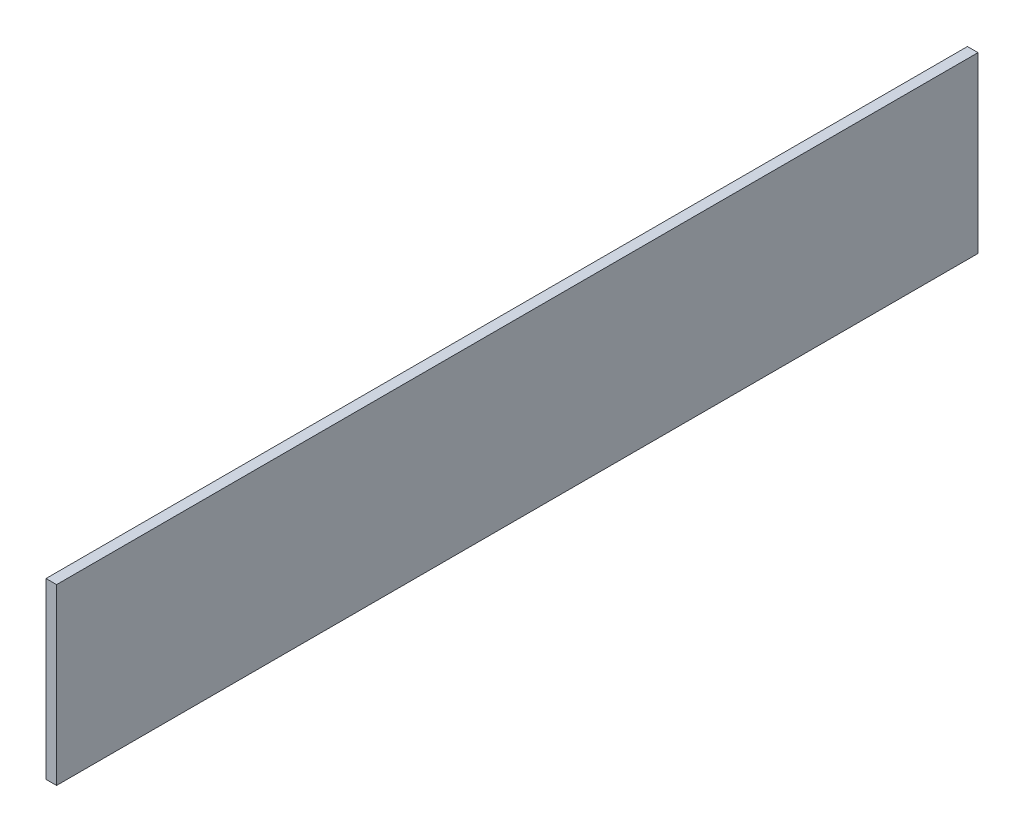
from build123d import *

# Parameters (mm, degrees)
SKETCH2_W           = 3.403820787
SKETCH2_H           = 296.618940246
BOSS_EXTRUDE1_DEPTH = 56


with BuildPart() as part:
    # Sketch2 → Boss-Extrude1 (new body)
    with BuildSketch(Plane(origin=(0, 0, 0), x_dir=(1, 0, 0), z_dir=(0, 1, 0))):
        with Locations((-107.135728808, 0)):
            Rectangle(SKETCH2_W, SKETCH2_H)
    extrude(amount=BOSS_EXTRUDE1_DEPTH)


solid = part.part
